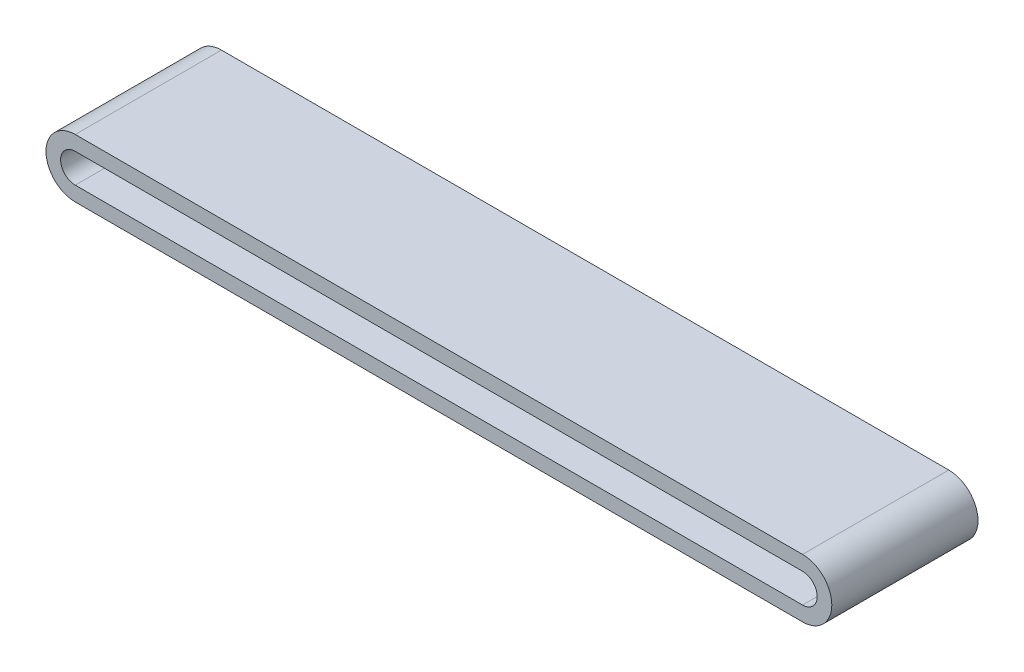
from build123d import *

# Parameters (mm, degrees)
ESTRUSIONE_ESTRUSIONE1_DEPTH = 20


with BuildPart() as part:
    # Schizzo1 → Estrusione-Estrusione1 (new body)
    with BuildSketch(Plane.XY):
        with BuildLine():
            Line((-49.75, 4), (49.75, 4))
            ThreePointArc((49.75, 4), (53.75, 0), (49.75, -4))
            Line((49.75, -4), (-49.75, -4))
            ThreePointArc((-49.75, -4), (-53.75, 0), (-49.75, 4))
        make_face()
        with BuildLine():
            Line((-49.75, 2), (49.75, 2))
            ThreePointArc((49.75, 2), (51.75, 0), (49.75, -2))
            Line((49.75, -2), (-49.75, -2))
            ThreePointArc((-49.75, -2), (-51.75, 0), (-49.75, 2))
        make_face(mode=Mode.SUBTRACT)
    extrude(amount=ESTRUSIONE_ESTRUSIONE1_DEPTH)


solid = part.part
